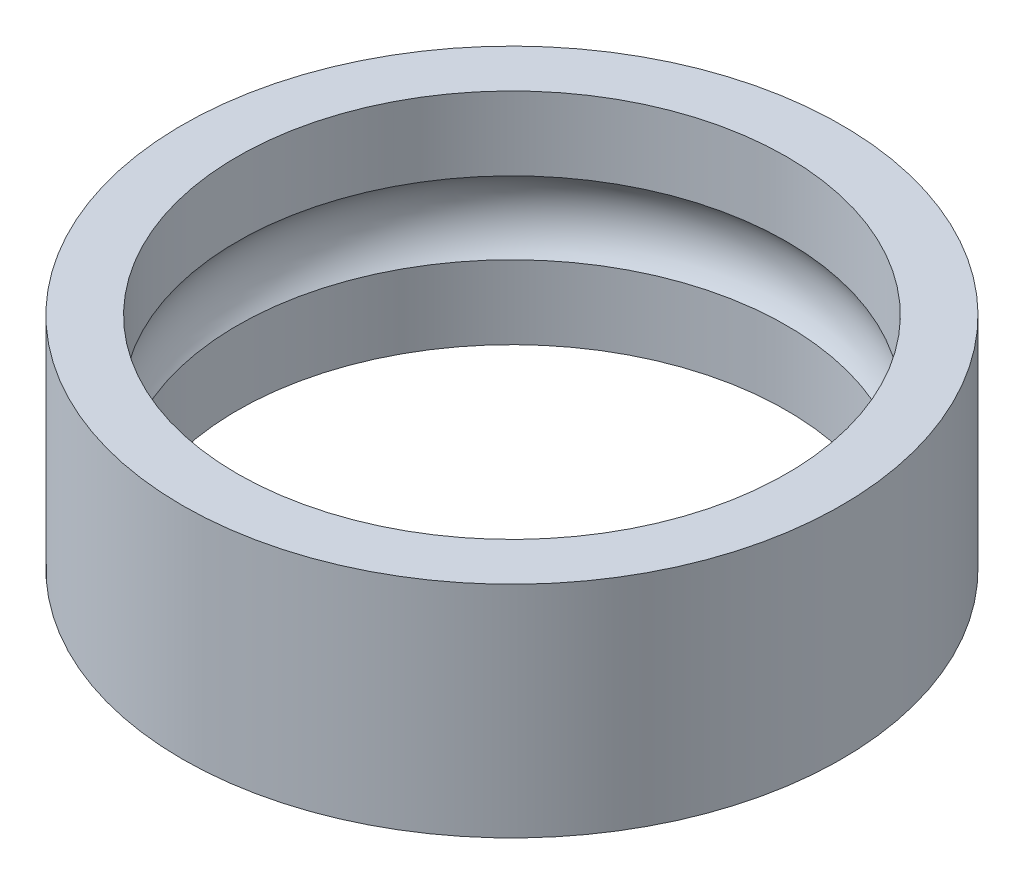
from build123d import *

# Parameters (mm, degrees)
DIAPROFILES_R         = 3
DIAPROFILES_R_2       = 2.5
DIAPROFILE_DEPTH      = 1
BEARINGPATHPROFILES_R = 0.5


with BuildPart() as part:
    # DiaProfileS → DiaProfile (new, symmetric)
    with BuildSketch(Plane(origin=(0, 0, 0), x_dir=(1, 0, 0), z_dir=(0, 1, 0))):
        with Locations(Location((0, 0, 0), (0, 0, 270))):
            Circle(DIAPROFILES_R)
        with Locations(Location((0, 0, 0), (0, 0, 270))):
            Circle(DIAPROFILES_R_2, mode=Mode.SUBTRACT)
    extrude(amount=DIAPROFILE_DEPTH, both=True)

    # BearingPathProfileS → BearingPathProfile (revolve, cut)
    with BuildSketch(Plane.XY, mode=Mode.PRIVATE) as bearingpathprofile_sk:
        with Locations((2.125, 0)):
            Circle(BEARINGPATHPROFILES_R)
    revolve(bearingpathprofile_sk.sketch.rotate(Axis((0, 1, 0), (0, -1, 0)), 90), axis=Axis((0, 1, 0), (0, -1, 0)), mode=Mode.SUBTRACT)


solid = part.part
